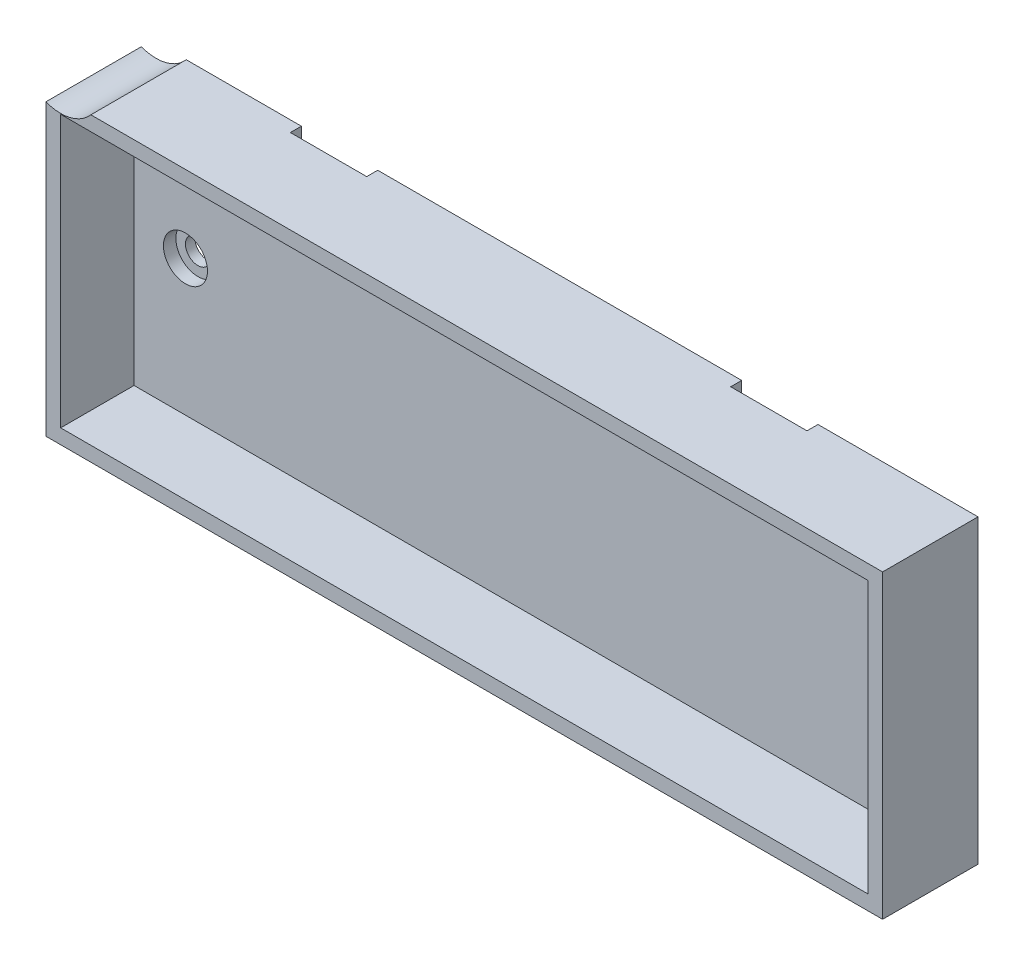
from build123d import *

# Parameters (mm, degrees)
MAIN_PROFILE_SKETCH_W       = 110
MAIN_PROFILE_SKETCH_H       = 37
MAIN_EXTRUSION_DEPTH        = 10
DETAIL_PROFILE_2_SKETCH_R   = 3
DETAIL_EXTRUSION_2_DEPTH    = 1.5
DETAIL_PROFILE_3_SKETCH_R   = 3
DETAIL_PROFILE_3_SKETCH_W   = 21.8
DETAIL_PROFILE_3_SKETCH_H   = 41
DETAIL_PROFILE_3_SKETCH_W_2 = 49.6
DETAIL_EXTRUSION_3_DEPTH    = 0.2
DETAIL_PROFILE_4_SKETCH_R   = 1.7
DETAIL_PROFILE_4_SKETCH_W   = 49.6
DETAIL_PROFILE_4_SKETCH_H   = 41
DETAIL_PROFILE_4_SKETCH_W_2 = 21.8
DETAIL_EXTRUSION_4_DEPTH    = 1.3


with BuildPart() as part:
    # Main Profile Sketch → Main Extrusion (new body)
    with BuildSketch(Plane.XY.offset(61.5)):
        with BuildLine():
            Line((-265.887822961, 47), (-158, 47))
            Line((-158, 47), (-158, 6))
            Line((-158, 6), (-272, 6))
            Line((-272, 6), (-272, 45.484025518))
            ThreePointArc((-272, 45.484025518), (-268.700050917, 45.258804298), (-265.887822961, 47))
        make_face()
        with Locations((-215, 26.5)):
            Rectangle(MAIN_PROFILE_SKETCH_W, MAIN_PROFILE_SKETCH_H, mode=Mode.SUBTRACT)
    extrude(amount=-MAIN_EXTRUSION_DEPTH)

    # Detail Profile 2 Sketch → Detail Extrusion 2 (add)
    with BuildSketch(Plane.XY.offset(51.5)):
        with BuildLine():
            Line((-265.887822961, 47), (-158, 47))
            Line((-158, 47), (-158, 6))
            Line((-158, 6), (-272, 6))
            Line((-272, 6), (-272, 45.484025518))
            ThreePointArc((-272, 45.484025518), (-268.700050917, 45.258804298), (-265.887822961, 47))
        make_face()
        with Locations((-263, 26.5)):
            Circle(DETAIL_PROFILE_2_SKETCH_R, mode=Mode.SUBTRACT)
        with Locations((-167, 26.5)):
            Circle(DETAIL_PROFILE_2_SKETCH_R, mode=Mode.SUBTRACT)
    extrude(amount=-DETAIL_EXTRUSION_2_DEPTH)

    # Detail Profile 3 Sketch → Detail Extrusion 3 (add)
    # profile 1 of 3: a face of its own
    with BuildSketch(Plane.XY.offset(50)):
        with BuildLine():
            Line((-265.887822961, 47), (-250.2, 47))
            Line((-250.2, 47), (-250.2, 6))
            Line((-250.2, 6), (-272, 6))
            Line((-272, 6), (-272, 45.484025518))
            ThreePointArc((-272, 45.484025518), (-268.700050917, 45.258804298), (-265.887822961, 47))
        make_face()
        with Locations((-263, 26.5)):
            Circle(DETAIL_PROFILE_3_SKETCH_R, mode=Mode.SUBTRACT)
    # profile 2 of 3: a face of its own
    with BuildSketch(Plane.XY.offset(50)):
        with Locations((-168.9, 26.5)):
            Rectangle(DETAIL_PROFILE_3_SKETCH_W, DETAIL_PROFILE_3_SKETCH_H)
        with Locations((-167, 26.5)):
            Circle(DETAIL_PROFILE_3_SKETCH_R, mode=Mode.SUBTRACT)
    # profile 3 of 3: a face of its own
    with BuildSketch(Plane.XY.offset(50)):
        with Locations((-215, 26.5)):
            Rectangle(DETAIL_PROFILE_3_SKETCH_W_2, DETAIL_PROFILE_3_SKETCH_H)
    extrude(amount=-DETAIL_EXTRUSION_3_DEPTH)

    # Detail Profile 4 Sketch → Detail Extrusion 4 (add)
    # profile 1 of 3: a face of its own
    with BuildSketch(Plane.XY.offset(49.8)):
        with BuildLine():
            Line((-265.887822961, 47), (-250.2, 47))
            Line((-250.2, 47), (-250.2, 6))
            Line((-250.2, 6), (-272, 6))
            Line((-272, 6), (-272, 45.484025518))
            ThreePointArc((-272, 45.484025518), (-268.700050917, 45.258804298), (-265.887822961, 47))
        make_face()
        with Locations((-263, 26.5)):
            Circle(DETAIL_PROFILE_4_SKETCH_R, mode=Mode.SUBTRACT)
    # profile 2 of 3: a face of its own
    with BuildSketch(Plane.XY.offset(49.8)):
        with Locations((-215, 26.5)):
            Rectangle(DETAIL_PROFILE_4_SKETCH_W, DETAIL_PROFILE_4_SKETCH_H)
    # profile 3 of 3: a face of its own
    with BuildSketch(Plane.XY.offset(49.8)):
        with Locations((-168.9, 26.5)):
            Rectangle(DETAIL_PROFILE_4_SKETCH_W_2, DETAIL_PROFILE_4_SKETCH_H)
        with Locations((-167, 26.5)):
            Circle(DETAIL_PROFILE_4_SKETCH_R, mode=Mode.SUBTRACT)
    extrude(amount=-DETAIL_EXTRUSION_4_DEPTH)


solid = part.part
